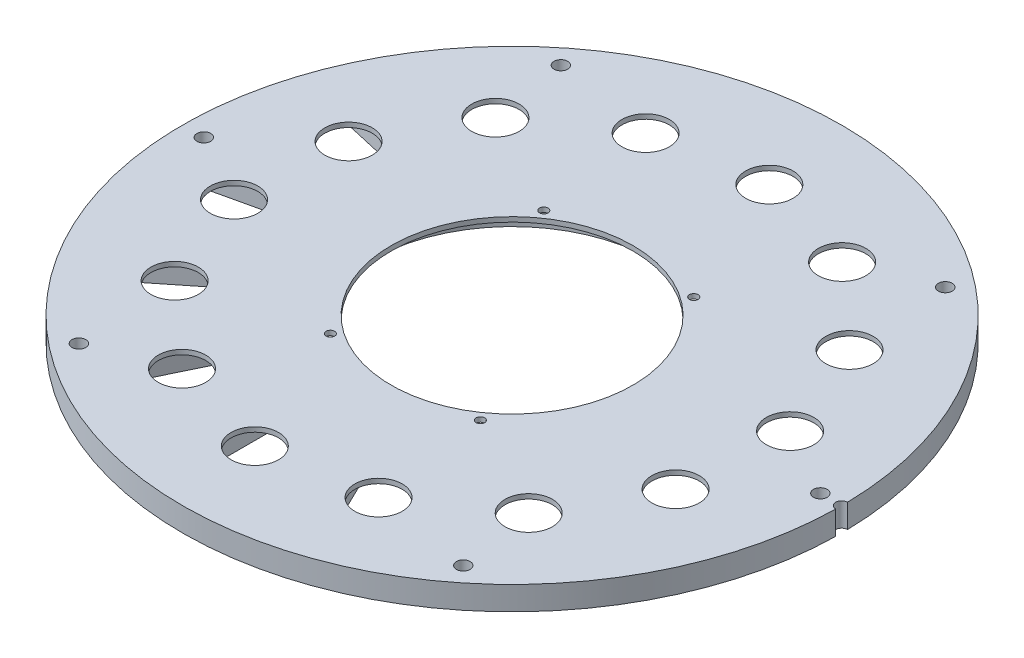
from build123d import *

# Parameters (mm, degrees)
SKETCH_1_R               = 139
EXTRUDE_1_DEPTH          = 10
CUT_EXTRUDE_578_DEPTH    = 8
PATTERN_CIRCULAR_1_COUNT = 14
SKETCH_3_R               = 51
CUT_EXTRUDE_927_DEPTH    = 197.829875781
SKETCH_5_R               = 10
CUT_EXTRUDE_1077_DEPTH   = 197.738404995
PATTERN_CIRCULAR_2_COUNT = 14
HOLE_WIZARD_M3_D         = 3.6
MIRROR_2_COPY_1_D        = 3.6
M5SUPPORTINGPOLE_D       = 5.8
M5_SUPPORTING_POLE_D     = 5.8
MIRROR_4_COPY_1_D        = 5.8
MIRROR_4_COPY_2_D        = 5.8
MIRROR_4_COPY_3_D        = 5.8
SKETCH_15_R              = 5.1
CUT_EXTRUDE_7_DEPTH      = 5
MIRROR_6_COPY_1_SKETCH_R = 5.1
MIRROR_6_COPY_1_DEPTH    = 5
SKETCH_16_R              = 60
SKETCH_16_R_2            = 51
CUT_EXTRUDE_8_DEPTH      = 8
SKETCH_18_R              = 2.5
CUT_EXTRUDE_10_DEPTH     = 197.829875781


with BuildPart() as part:
    # ｽｹｯﾁ1 → ﾎﾞｽ - 押し出し1 (new body)
    with BuildSketch(Plane(origin=(0, 0, 0), x_dir=(1, 0, 0), z_dir=(0, 1, 0))):
        with Locations(Location((0, 0, 0), (0, 0, 270))):
            Circle(SKETCH_1_R)
    extrude(amount=EXTRUDE_1_DEPTH)

    # ｽｹｯﾁ2 → Cut-Extrude 578 (cut)
    with BuildSketch(Plane.XZ):
        with BuildLine():
            Line((18.5, 119), (18.5, 85))
            ThreePointArc((18.5, 85), (0, 66.5), (-18.5, 85))
            Line((-18.5, 85), (-18.5, 119))
            ThreePointArc((-18.5, 119), (0, 137.5), (18.5, 119))
        make_face()
    cut_extrude_578 = extrude(amount=-CUT_EXTRUDE_578_DEPTH, mode=Mode.SUBTRACT)

    # 円形ﾊﾟﾀｰﾝ1: Cut-Extrude 578 ×14 about axis
    pattern_circular_1_axis = Axis((0, 0, 0), (0, 1, 0))
    for i in range(1, PATTERN_CIRCULAR_1_COUNT):
        add(cut_extrude_578.rotate(pattern_circular_1_axis, i * 360 / PATTERN_CIRCULAR_1_COUNT), mode=Mode.SUBTRACT)

    # ｽｹｯﾁ3 → Cut-Extrude 927 (cut, through all)
    with BuildSketch(Plane(origin=(0, 0, 0), x_dir=(-1, 0, 0), z_dir=(0, -1, 0))):
        with Locations(Location((0, 0, 0), (0, 0, 90))):
            Circle(SKETCH_3_R)
    extrude(amount=-CUT_EXTRUDE_927_DEPTH, mode=Mode.SUBTRACT)

    # ｽｹｯﾁ5 → Cut-Extrude 1077 (cut, through all)
    with BuildSketch(Plane.XZ.offset(-8)):
        with Locations(Location((-6.5, 102, 0), (0, 0, 270))):
            Circle(SKETCH_5_R)
    cut_extrude_1077 = extrude(amount=-CUT_EXTRUDE_1077_DEPTH, mode=Mode.SUBTRACT)

    # 円形ﾊﾟﾀｰﾝ2: Cut-Extrude 1077 ×14 about axis
    pattern_circular_2_axis = Axis((0, 0, 0), (0, 1, 0))
    for i in range(1, PATTERN_CIRCULAR_2_COUNT):
        add(cut_extrude_1077.rotate(pattern_circular_2_axis, i * 360 / PATTERN_CIRCULAR_2_COUNT), mode=Mode.SUBTRACT)

    # M3(六角スペーサ) キールへの固定穴 (through all)
    with Locations(Plane(origin=(-31.622776602, 10, -45), x_dir=(0, 0, 1), z_dir=(0, 1, 0))):
        with Locations((0, 0)):
            hole_wizard_m3 = Hole(HOLE_WIZARD_M3_D / 2)

    # ﾐﾗｰ1: M3(六角スペーサ) キールへの固定穴 across plane
    add(hole_wizard_m3.mirror(Plane.XY), mode=Mode.SUBTRACT)

    # ﾐﾗｰ2: M3(六角スペーサ) キールへの固定穴 across plane
    add(hole_wizard_m3.mirror(Plane(origin=(0, 0, 0), x_dir=(0, 0, 1), z_dir=(1, 0, 0))), mode=Mode.SUBTRACT)

    # ﾐﾗｰ2 copy 1 (through all)
    with Locations(Plane(origin=(31.622776602, 10, 45), x_dir=(0, 0, -1), z_dir=(0, 1, 0))):
        with Locations((0, 0)):
            Hole(MIRROR_2_COPY_1_D / 2)

    # M5supportingpole用 (through all)
    with Locations(Plane(origin=(130, 0, 0), x_dir=(0, 0, -1), z_dir=(0, -1, 0))):
        with Locations((0, 0)):
            m5supportingpole = Hole(M5SUPPORTINGPOLE_D / 2)

    # M5 supporting_pole用 (through all)
    with Locations(Plane(origin=(81.053674242, 0, 101.638092721), x_dir=(0, 0, -1), z_dir=(0, -1, 0))):
        with Locations((0, 0)):
            m5_supporting_pole = Hole(M5_SUPPORTING_POLE_D / 2)

    # ﾐﾗｰ3: M5supportingpole用, M5 supporting_pole用 across plane
    add(m5supportingpole.mirror(Plane.XY), mode=Mode.SUBTRACT)
    add(m5_supporting_pole.mirror(Plane.XY), mode=Mode.SUBTRACT)

    # ﾐﾗｰ4: M5 supporting_pole用 across plane
    add(m5_supporting_pole.mirror(Plane(origin=(0, 0, 0), x_dir=(0, 0, 1), z_dir=(1, 0, 0))), mode=Mode.SUBTRACT)

    # ﾐﾗｰ4 copy 1 (through all)
    with Locations(Plane(origin=(-130, 0, 0), x_dir=(0, 0, 1), z_dir=(0, -1, 0))):
        with Locations((0, 0)):
            Hole(MIRROR_4_COPY_1_D / 2)

    # ﾐﾗｰ4 copy 2 (through all)
    with Locations(Plane(origin=(-81.053674242, 0, -101.638092721), x_dir=(0, 0, 1), z_dir=(0, -1, 0))):
        with Locations((0, 0)):
            Hole(MIRROR_4_COPY_2_D / 2)

    # ﾐﾗｰ4 copy 3 (through all)
    with Locations(Plane(origin=(-130, 0, 0), x_dir=(0, 0, -1), z_dir=(0, -1, 0))):
        with Locations((0, 0)):
            Hole(MIRROR_4_COPY_3_D / 2)

    # ｽｹｯﾁ15 → ｶｯﾄ - 押し出し7 (cut)
    with BuildSketch(Plane.XZ):
        with Locations(Location((81.053674242, 101.638092721, 0), (0, 0, 270))):
            Circle(SKETCH_15_R)
        with Locations(Location((130, 0, 0), (0, 0, 270))):
            Circle(SKETCH_15_R)
    cut_extrude_7 = extrude(amount=-CUT_EXTRUDE_7_DEPTH, mode=Mode.SUBTRACT)

    # ﾐﾗｰ5: ｶｯﾄ - 押し出し7 across plane
    add(cut_extrude_7.mirror(Plane.XY), mode=Mode.SUBTRACT)

    # ﾐﾗｰ6: ｶｯﾄ - 押し出し7 across plane
    add(cut_extrude_7.mirror(Plane(origin=(0, 0, 0), x_dir=(0, 0, 1), z_dir=(1, 0, 0))), mode=Mode.SUBTRACT)

    # ﾐﾗｰ6 copy 1 sketch → ﾐﾗｰ6 copy 1 (cut)
    with BuildSketch(Plane(origin=(0, 0, 0), x_dir=(-1, 0, 0), z_dir=(0, -1, 0))):
        with Locations(Location((81.053674242, 101.638092721, 0), (0, 0, 270))):
            Circle(MIRROR_6_COPY_1_SKETCH_R)
        with Locations(Location((130, 0, 0), (0, 0, 270))):
            Circle(MIRROR_6_COPY_1_SKETCH_R)
    extrude(amount=-MIRROR_6_COPY_1_DEPTH, mode=Mode.SUBTRACT)

    # ｽｹｯﾁ16 → ｶｯﾄ - 押し出し8 (cut)
    with BuildSketch(Plane.XZ):
        with Locations(Location((0, 0, 0), (0, 0, 270))):
            Circle(SKETCH_16_R)
        with Locations(Location((0, 0, 0), (0, 0, 270))):
            Circle(SKETCH_16_R_2, mode=Mode.SUBTRACT)
    extrude(amount=-CUT_EXTRUDE_8_DEPTH, mode=Mode.SUBTRACT)

    # ｽｹｯﾁ18 → ｶｯﾄ - 押し出し10 (cut, through all)
    with BuildSketch(Plane(origin=(0, 10, 0), x_dir=(1, 0, 0), z_dir=(0, 1, 0))):
        with Locations((139, 0)):
            Circle(SKETCH_18_R)
    extrude(amount=-CUT_EXTRUDE_10_DEPTH, mode=Mode.SUBTRACT)


solid = part.part
